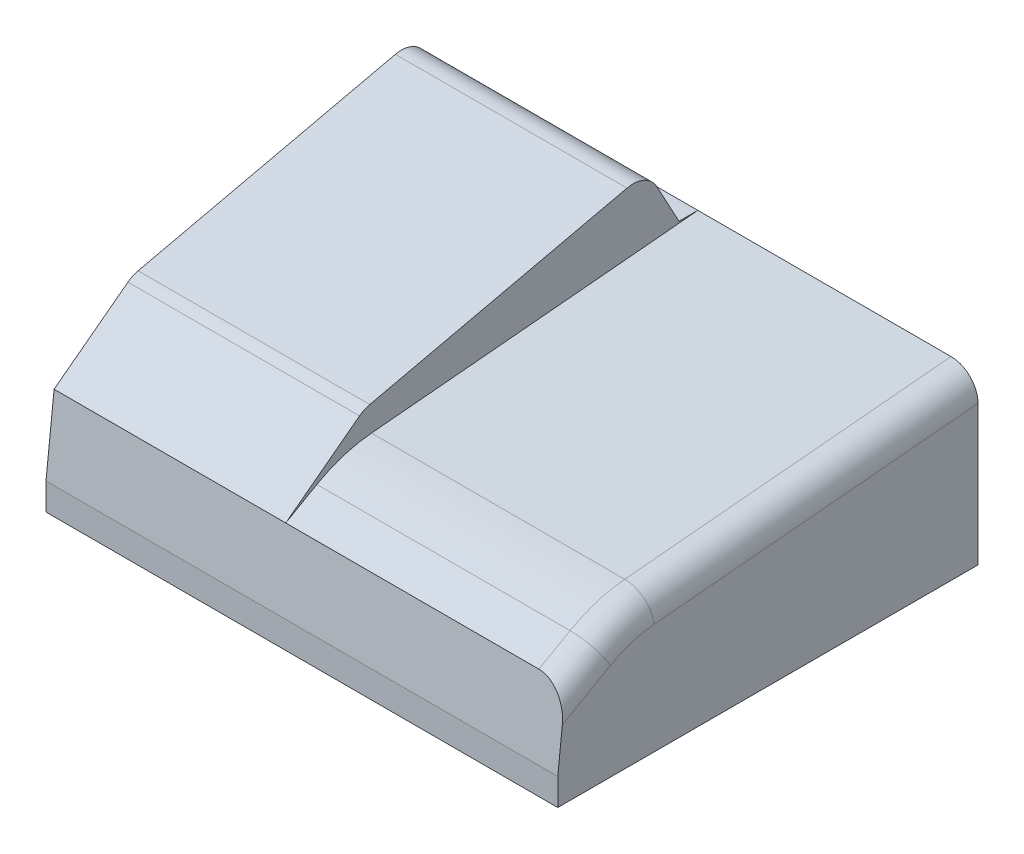
from build123d import *

# Parameters (mm, degrees)
SKETCH1_W           = 190
SKETCH1_H           = 156
BOSS_EXTRUDE1_DEPTH = 84
CUT_EXTRUDE1_DEPTH  = 222.900878772
CUT_EXTRUDE2_DEPTH  = 104
FILLET1_R           = 50
FILLET2_R           = 10
FILLET3_R           = 10


with BuildPart() as part:
    # Sketch1 → Boss-Extrude1 (new body)
    with BuildSketch(Plane(origin=(0, 0, 0), x_dir=(1, 0, 0), z_dir=(0, 1, 0))):
        Rectangle(SKETCH1_W, SKETCH1_H)
    extrude(amount=BOSS_EXTRUDE1_DEPTH)

    # Sketch2 → Cut-Extrude1 (cut, through all)
    with BuildSketch(Plane.ZY.offset(95)):
        Polygon((-78, 84), (-78, 62), (-71, 62), (-59.118583078, 84), align=None)
        Polygon((78, 84), (-59.118583078, 84), (45.881416922, 60), (75, 38), (78, 10), align=None)
    extrude(amount=-CUT_EXTRUDE1_DEPTH, mode=Mode.SUBTRACT)

    # Sketch3 → Cut-Extrude2 (cut)
    with BuildSketch(Plane(origin=(95, 0, 0), x_dir=(0, 0, -1), z_dir=(1, 0, 0))):
        Polygon((-54, 50), (-75, 38), (-45.881416922, 60), (59.118583078, 84), (71, 62), (78, 62), align=None)
    extrude(amount=-CUT_EXTRUDE2_DEPTH, mode=Mode.SUBTRACT)

    # Fillet1
    fillet1_edges = [part.edges().sort_by_distance(p)[0] for p in [
        (43, 50, 54),
    ]]
    fillet(fillet1_edges, radius=FILLET1_R)

    # Fillet2
    fillet2_edges = [part.edges().sort_by_distance(p)[0] for p in [
        (-52, 84, -59.118583078),
    ]]
    fillet(fillet2_edges, radius=FILLET2_R)

    # Fillet3
    fillet3_edges = [part.edges().sort_by_distance(p)[0] for p in [
        (-52, 60, 45.881416922),
        (95, 56.49247454, -17.417219937),
        (95, 41.301222931, 69.22285987),
        (95, 48.884092571, 53.64880539),
    ]]
    fillet(fillet3_edges, radius=FILLET3_R)


solid = part.part
